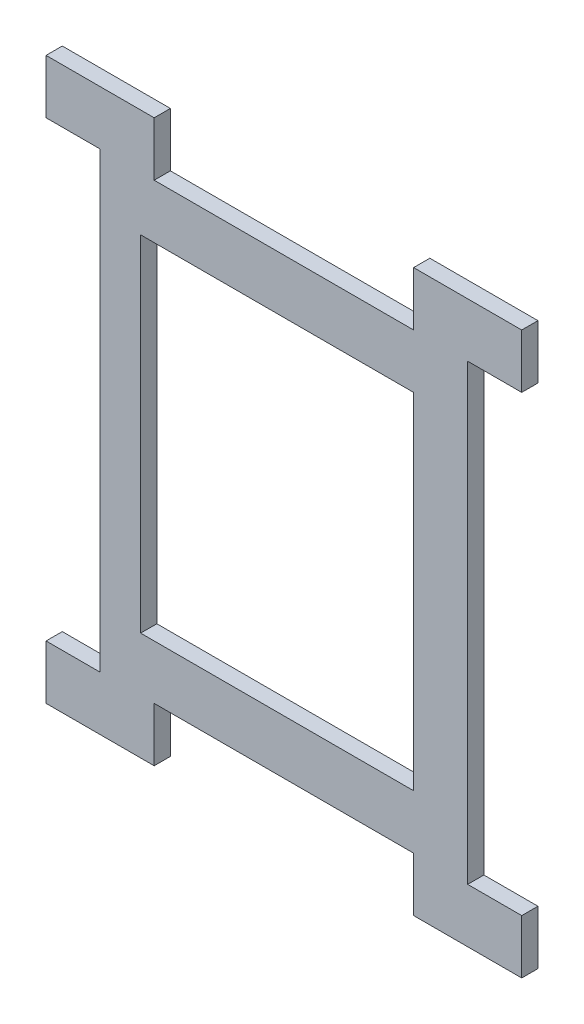
from build123d import *

# Parameters (mm, degrees)
SKETCH_1_W      = 50.495835616
SKETCH_1_H      = 63.809419048
EXTRUDE_1_DEPTH = 3


with BuildPart() as part:
    # Эскиз1 → Бобышка-Вытянуть1 (new body)
    with BuildSketch(Plane.XY):
        Polygon((-37.190716428, 32.897269442), (-37.190716428, 22.897269442), (-27.190716428, 22.897269442), (-27.190716428, -60.912149606), (-37.190716428, -60.912149606), (-37.190716428, -70.912149606), (-17.190716428, -70.912149606), (-17.190716428, -60.912149606), (30.798771006, -60.912149606), (30.798771006, -70.912149606), (50.798771006, -70.912149606), (50.798771006, -60.912149606), (40.798771006, -60.912149606), (40.798771006, 22.897269442), (50.798771006, 22.897269442), (50.798771006, 32.897269442), (30.798771006, 32.897269442), (30.798771006, 22.897269442), (-17.190716428, 22.897269442), (-17.190716428, 32.897269442), align=None)
        with Locations((5.550853198, -19.007440082)):
            Rectangle(SKETCH_1_W, SKETCH_1_H, mode=Mode.SUBTRACT)
    extrude(amount=EXTRUDE_1_DEPTH)


solid = part.part
